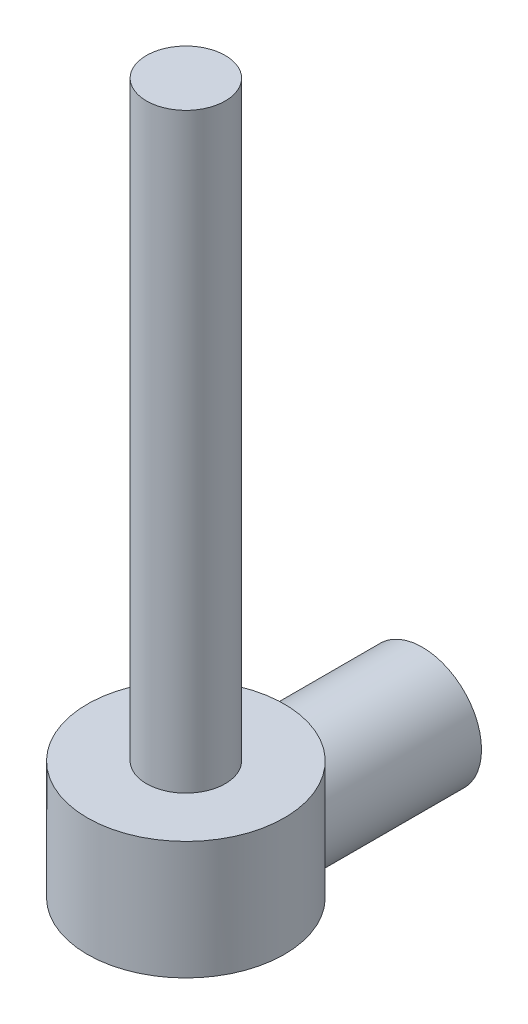
from build123d import *

# Parameters (mm, degrees)
SKETCH1_R                = 30
BOSS_EXTRUDE1_DEPTH      = 120
BOSS_EXTRUDE2_DEPTH      = 40
BOSS_EXTRUDE2_DEPTH_BACK = 20
SKETCH2_R                = 50
SKETCH3_R                = 20
BOSS_EXTRUDE3_DEPTH      = 300


with BuildPart() as part:
    # Sketch1 → Boss-Extrude1 (new body)
    with BuildSketch(Plane.XY):
        Circle(SKETCH1_R)
    extrude(amount=-BOSS_EXTRUDE1_DEPTH)

    # Sketch2 → Boss-Extrude2 (add, two sides: drawn at the far end of the back side and taken through both)
    with BuildSketch(Plane(origin=(0, 0, 0), x_dir=(1, 0, 0), z_dir=(0, 1, 0)).offset(-BOSS_EXTRUDE2_DEPTH_BACK)):
        Circle(SKETCH2_R)
    extrude(amount=BOSS_EXTRUDE2_DEPTH + BOSS_EXTRUDE2_DEPTH_BACK)

    # Sketch3 → Boss-Extrude3 (add)
    with BuildSketch(Plane(origin=(0, 40, 0), x_dir=(1, 0, 0), z_dir=(0, 1, 0))):
        Circle(SKETCH3_R)
    extrude(amount=BOSS_EXTRUDE3_DEPTH)


solid = part.part
